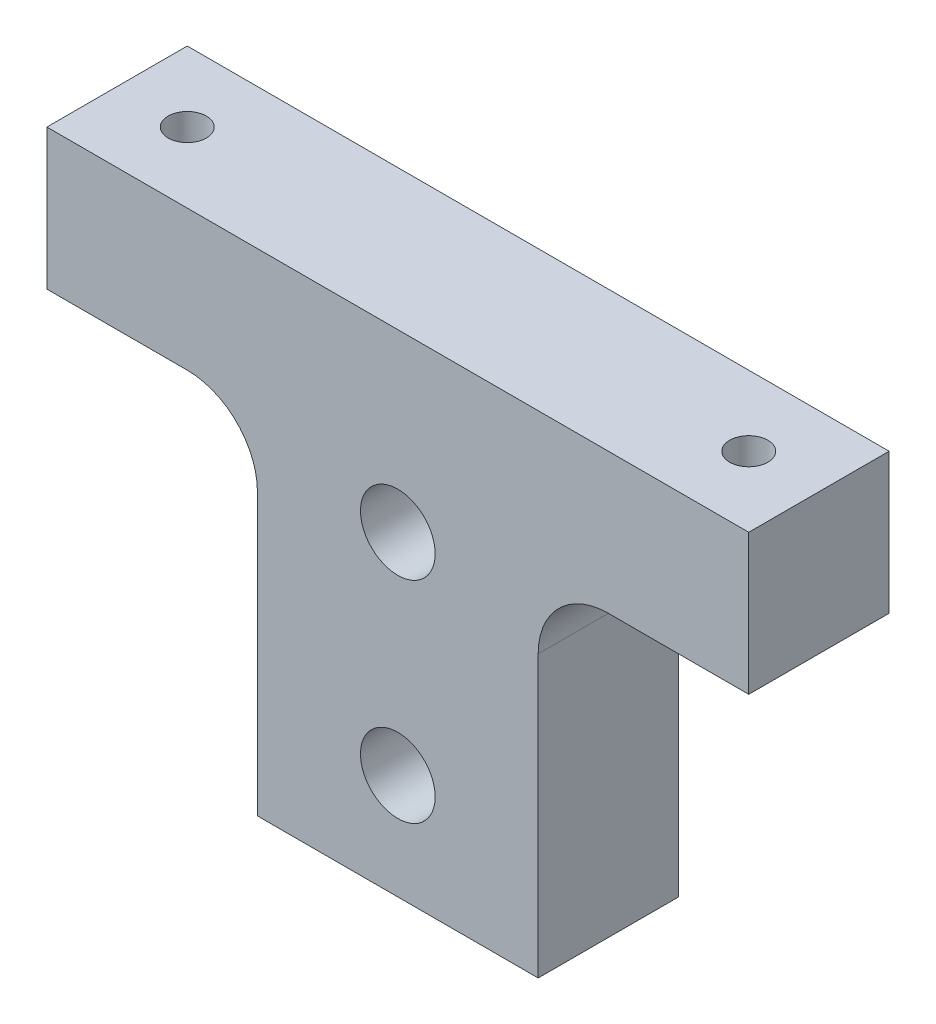
from build123d import *

# Parameters (mm, degrees)
BOSS_EXTRUDE1_DEPTH       = 12.7
FILLET1_R                 = 6.35
F_1_4_CLEARANCE_HOLE1_D   = 6.7564
TAP_DRILL_FOR_8_32_TAP1_D = 3.4544


with BuildPart() as part:
    # Sketch1 → Boss-Extrude1 (new body)
    with BuildSketch(Plane.XY):
        Polygon((12.7, 15.875), (31.75, 15.875), (31.75, 28.575), (-31.75, 28.575), (-31.75, 15.875), (-12.7, 15.875), (-12.7, -15.875), (12.7, -15.875), align=None)
    extrude(amount=BOSS_EXTRUDE1_DEPTH)

    # Fillet1
    fillet1_edges = [part.edges().sort_by_distance(p)[0] for p in [
        (-12.7, 15.875, 6.35),
        (12.7, 15.875, 6.35),
    ]]
    fillet(fillet1_edges, radius=FILLET1_R)

    # 1/4 Clearance Hole1 (through all)
    with Locations(Plane.XY.offset(12.7)):
        with Locations((0, -6.35), (0, 12.7)):
            Hole(F_1_4_CLEARANCE_HOLE1_D / 2)

    # Tap Drill for #8-32 Tap1 (through all)
    with Locations(Plane(origin=(0, 15.875, 0), x_dir=(-1, 0, 0), z_dir=(0, -1, 0))):
        with Locations((-25.4, -6.35), (25.4, -6.35)):
            Hole(TAP_DRILL_FOR_8_32_TAP1_D / 2)


solid = part.part
